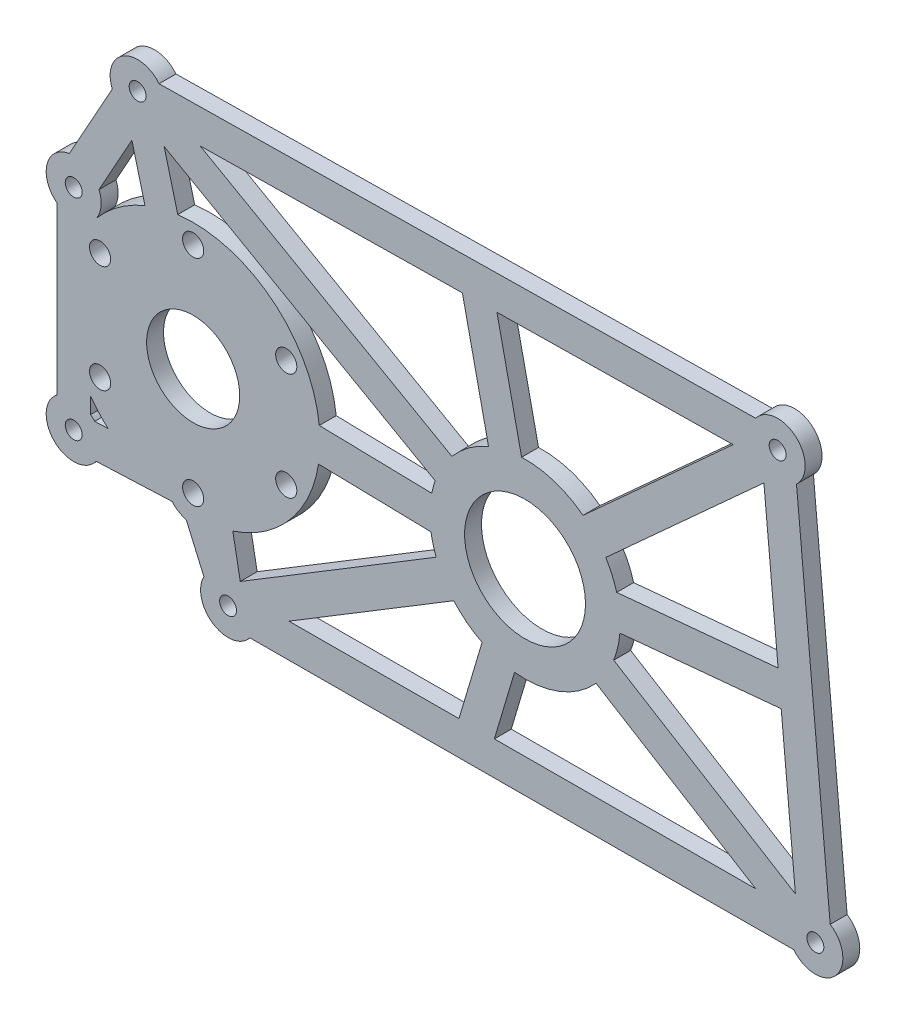
from build123d import *

# Parameters (mm, degrees)
SKETCH1_W           = 267.603014698
SKETCH1_H           = 153.453144762
SKETCH1_R           = 2
SKETCH1_R_2         = 14.29
SKETCH1_R_3         = 2.499999953
SKETCH1_R_4         = 11
BOSS_EXTRUDE1_DEPTH = 4
SKETCH2_W           = 305.655174706
SKETCH2_H           = 186.291776367
CUT_EXTRUDE8_DEPTH  = 10


with BuildPart() as part:
    # Sketch1 → Boss-Extrude1 (new body)
    with BuildSketch(Plane.XY):
        with Locations((77.263379783, -10.843771022)):
            Rectangle(SKETCH1_W, SKETCH1_H)
        with Locations((-4.85811184, -43.49422294)):
            Circle(SKETCH1_R, mode=Mode.SUBTRACT)
        with Locations((101.811349412, -18.649052962)):
            Circle(SKETCH1_R_2, mode=Mode.SUBTRACT)
        with Locations((31.633252021, -61.264657987)):
            Circle(SKETCH1_R, mode=Mode.SUBTRACT)
        with Locations((10.251922178, 33.361755578)):
            Circle(SKETCH1_R, mode=Mode.SUBTRACT)
        with Locations((170.426367515, -60.775756941)):
            Circle(SKETCH1_R, mode=Mode.SUBTRACT)
        with Locations((161.513898191, 35.55251649)):
            Circle(SKETCH1_R, mode=Mode.SUBTRACT)
        with Locations((-4.85811184, 6.145317428)):
            Circle(SKETCH1_R, mode=Mode.SUBTRACT)
        with Locations((23.377209906, -42.310207828)):
            Circle(SKETCH1_R_3, mode=Mode.SUBTRACT)
        with Locations((23.377209906, -16.910207828)):
            Circle(SKETCH1_R_4, mode=Mode.SUBTRACT)
        with Locations((1.38016465, -29.610207828)):
            Circle(SKETCH1_R_3, mode=Mode.SUBTRACT)
        with Locations((1.38016465, -4.210207828)):
            Circle(SKETCH1_R_3, mode=Mode.SUBTRACT)
        with Locations((23.377209906, 8.489792172)):
            Circle(SKETCH1_R_3, mode=Mode.SUBTRACT)
        with Locations((45.374255162, -4.210207828)):
            Circle(SKETCH1_R_3, mode=Mode.SUBTRACT)
        with Locations((45.374255162, -29.610207828)):
            Circle(SKETCH1_R_3, mode=Mode.SUBTRACT)
    extrude(amount=BOSS_EXTRUDE1_DEPTH)

    # Sketch2 → Cut-Extrude8 (cut)
    # profile 1 of 11: a face of its own
    with BuildSketch(Plane.XY.offset(4)):
        with Locations((67.603615112, -0.467239306)):
            Rectangle(SKETCH2_W, SKETCH2_H)
        with BuildLine():
            Line((15.316933469, 37.435532771), (156.333033267, 39.477900374))
            ThreePointArc((156.333033267, 39.477900374), (159.128219206, 41.598881992), (162.618590728, 41.957955929))
            ThreePointArc((162.618590728, 41.957955929), (163.868628825, 41.61100175), (165.024869365, 41.022715885))
            ThreePointArc((165.024869365, 41.022715885), (167.217901725, 38.66930068), (168.013898191, 35.55251649))
            ThreePointArc((168.013898191, 35.55251649), (167.480787607, 32.974488039), (165.968904131, 30.819343974))
            Line((165.968904131, 30.819343974), (173.937338688, -55.305557546))
            ThreePointArc((173.937338688, -55.305557546), (176.130371049, -57.658972751), (176.926367515, -60.775756941))
            ThreePointArc((176.926367515, -60.775756941), (172.552302777, -66.918264512), (165.317013897, -64.79377954))
            Line((165.317013897, -64.79377954), (36.770785596, -65.246585756))
            ThreePointArc((36.770785596, -65.246585756), (28.080665231, -66.707922367), (25.920047751, -58.164771381))
            Line((25.920047751, -58.164771381), (21.755974451, -48.604776567))
            ThreePointArc((21.755974451, -48.604776567), (19.929745718, -47.82065161), (18.425821295, -46.521353851))
            Line((18.425821295, -46.521353851), (0.428452826, -47.276052396))
            ThreePointArc((0.428452826, -47.276052396), (-9.356992337, -48.185712497), (-8.85811184, -38.370747557))
            Line((-8.85811184, -38.370747557), (-8.85811184, 1.021842045))
            ThreePointArc((-8.85811184, 1.021842045), (-11.150528938, 7.774883952), (-5.868402241, 12.566323058))
            Line((-5.868402241, 12.566323058), (4.267840814, 30.823888318))
            ThreePointArc((4.267840814, 30.823888318), (3.803217243, 34.176743104), (5.087377177, 37.308586577))
            ThreePointArc((5.087377177, 37.308586577), (6.293465571, 38.517395333), (7.772745355, 39.370389556))
            ThreePointArc((7.772745355, 39.370389556), (11.866714012, 39.657980425), (15.316933469, 37.435532771))
        make_face(mode=Mode.SUBTRACT)
    # profile 2 of 11: a face of its own
    with BuildSketch(Plane.XY.offset(4)):
        with BuildLine():
            Line((87.009313409, 30.473030477), (25.016174455, 29.575170029))
            Line((25.016174455, 29.575170029), (84.534856694, -4.234726778))
            ThreePointArc((84.534856694, -4.234726778), (88.475465617, -0.527126923), (93.187242807, 2.132544312))
            Line((93.187242807, 2.132544312), (87.009313409, 30.473030477))
        make_face()
    # profile 3 of 11: a face of its own
    with BuildSketch(Plane.XY.offset(4)):
        with BuildLine():
            Line((115.516142216, -0.804483643), (150.988719582, 31.399658477))
            Line((150.988719582, 31.399658477), (95.171415855, 30.591244026))
            Line((95.171415855, 30.591244026), (101.003681787, 3.83644621))
            ThreePointArc((101.003681787, 3.83644621), (108.66470749, 2.781800569), (115.516142216, -0.804483643))
        make_face()
    # profile 4 of 11: a face of its own
    with BuildSketch(Plane.XY.offset(4)):
        with BuildLine():
            Line((158.26921014, 27.20426024), (120.893532253, -6.72763115))
            ThreePointArc((120.893532253, -6.72763115), (122.397082717, -9.567335928), (123.480802665, -12.592255482))
            Line((123.480802665, -12.592255482), (161.619207477, -9.003377368))
            Line((161.619207477, -9.003377368), (158.26921014, 27.20426024))
        make_face()
    # profile 5 of 11: a face of its own
    with BuildSketch(Plane.XY.offset(4)):
        with BuildLine():
            Line((122.77328809, -26.825062188), (165.706925432, -53.184490212))
            Line((165.706925432, -53.184490212), (162.356235259, -16.969364249))
            Line((162.356235259, -16.969364249), (124.230302911, -20.557068686))
            ThreePointArc((124.230302911, -20.557068686), (123.727037564, -23.743423664), (122.77328809, -26.825062188))
        make_face()
    # profile 6 of 11: a face of its own
    with BuildSketch(Plane.XY.offset(4)):
        with BuildLine():
            Line((94.560961812, -57.042969272), (156.346956485, -56.825327083))
            Line((156.346956485, -56.825327083), (118.587568032, -33.642667897))
            ThreePointArc((118.587568032, -33.642667897), (109.853001514, -39.662901526), (99.330831485, -41.011902307))
            Line((99.330831485, -41.011902307), (94.560961812, -57.042969272))
        make_face()
    # profile 7 of 11: a face of its own
    with BuildSketch(Plane.XY.offset(4)):
        with BuildLine():
            Line((84.962067713, -33.560515205), (46.010236401, -57.213990006))
            Line((46.010236401, -57.213990006), (86.20559517, -57.072401189))
            Line((86.20559517, -57.072401189), (91.663047334, -38.730436503))
            ThreePointArc((91.663047334, -38.730436503), (88.067281455, -36.463389772), (84.962067713, -33.560515205))
        make_face()
    # profile 8 of 11: a face of its own
    with BuildSketch(Plane.XY.offset(4)):
        with BuildLine():
            ThreePointArc((80.809710516, -26.722538187), (80.077925828, -24.47213628), (79.586542538, -22.157323106))
            Line((79.586542538, -22.157323106), (53.013387432, -21.568209721))
            ThreePointArc((53.013387432, -21.568209721), (46.235949771, -36.339001197), (32.750489376, -45.408306571))
            Line((32.750489376, -45.408306571), (34.506149029, -54.840346462))
            Line((34.506149029, -54.840346462), (80.809710516, -26.722538187))
        make_face()
    # profile 9 of 11: a face of its own
    with BuildSketch(Plane.XY.offset(4)):
        with BuildLine():
            ThreePointArc((79.763854917, -14.159288328), (80.122803307, -12.660984172), (80.583447278, -11.190757516))
            Line((80.583447278, -11.190757516), (16.516137359, 25.203010887))
            Line((16.516137359, 25.203010887), (19.736612333, 12.868073675))
            ThreePointArc((19.736612333, 12.868073675), (41.978293765, 6.62698995), (53.190699811, -13.570174942))
            Line((53.190699811, -13.570174942), (79.763854917, -14.159288328))
        make_face()
    # profile 10 of 11: a face of its own
    with BuildSketch(Plane.XY.offset(4)):
        with BuildLine():
            Line((11.996082824, 10.847132577), (8.903504201, 22.692206192))
            Line((8.903504201, 22.692206192), (1.125969524, 8.683184687))
            ThreePointArc((1.125969524, 8.683184687), (1.511602787, 7.440205673), (1.64188816, 6.145317428))
            ThreePointArc((1.64188816, 6.145317428), (1.374954172, 4.30171007), (0.59607644, 2.609524701))
            ThreePointArc((0.59607644, 2.609524701), (5.806508232, 7.405845361), (11.996082824, 10.847132577))
        make_face()
    # profile 11 of 11: a face of its own
    with BuildSketch(Plane.XY.offset(4)):
        with BuildLine():
            Line((-0.85811184, -34.592096299), (-0.85811184, -38.370747557))
            ThreePointArc((-0.85811184, -38.370747557), (-0.359231342, -38.802733382), (0.093276771, -39.283076917))
            Line((0.093276771, -39.283076917), (3.243928256, -39.150958041))
            ThreePointArc((3.243928256, -39.150958041), (1.076110226, -36.976621387), (-0.85811184, -34.592096299))
        make_face()
    extrude(amount=-CUT_EXTRUDE8_DEPTH, mode=Mode.SUBTRACT)


solid = part.part
